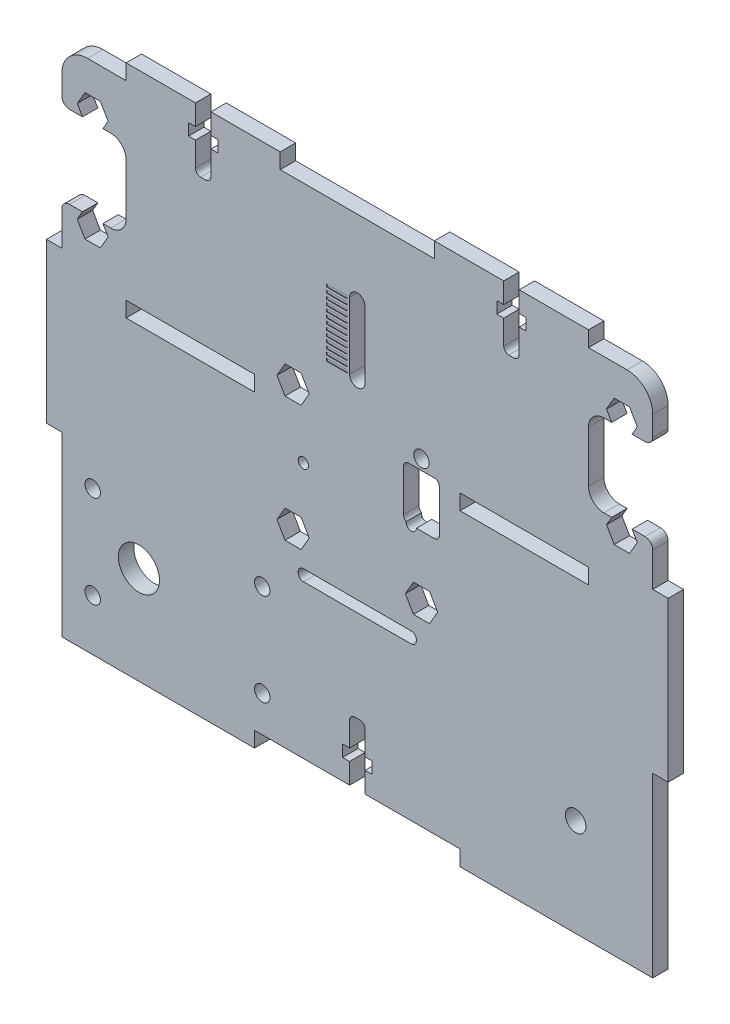
from build123d import *

# Parameters (mm, degrees)
ESBO_O1_W                   = 115
ESBO_O1_H                   = 100
RESSALTO_EXTRUS_O1_DEPTH    = 1.5
ESBO_O2_W                   = 40
ESBO_O2_H                   = 3
ESBO_O2_W_2                 = 25
CORTE_EXTRUS_O1_DEPTH       = 77.257786488
ESBO_O3_W                   = 3
ESBO_O3_H                   = 31
ESBO_O3_W_2                 = 30
ESBO_O3_H_2                 = 3
RESSALTO_EXTRUS_O2_DEPTH    = 3
CORTE_EXTRUS_O11_DEPTH      = 81.487576681
CORTE_EXTRUS_O11_DEPTH_BACK = 81.487576681
ESBO_O30_R                  = 4
CORTE_EXTRUS_O12_DEPTH      = 81.487576681
CORTE_EXTRUS_O12_DEPTH_BACK = 81.487576681
ESBO_O31_R                  = 1.5
ESBO_O4_R                   = 2
CORTE_EXTRUS_O2_DEPTH       = 81.487576681
CUT_EXTRUDE2_DEPTH          = 81.445633816
CUT_EXTRUDE2_DEPTH_BACK     = 81.445633816
CUT_EXTRUDE6_DEPTH          = 81.487576681
CUT_EXTRUDE6_DEPTH_BACK     = 81.487576681
FILLET2_R                   = 1.5
CUT_EXTRUDE8_DEPTH          = 81.445633816
CUT_EXTRUDE8_DEPTH_BACK     = 81.445633816
CUT_EXTRUDE12_DEPTH         = 81.445633816
CUT_EXTRUDE12_DEPTH_BACK    = 81.445633816
SKETCH16_R                  = 1.5
CORTE_EXTRUS_O13_DEPTH      = 81.445633816
CORTE_EXTRUS_O13_DEPTH_BACK = 81.445633816
ESBO_O32_R                  = 1
CUT_EXTRUDE9_DEPTH          = 81.487576681
FILLET1_R                   = 5
SKETCH12_4_W                = 4
SKETCH12_4_H                = 0.5
CUT_EXTRUDE13_DEPTH         = 0.1


with BuildPart() as part:
    # Esboço1 → Ressalto-extrusão1 (new, symmetric)
    with BuildSketch(Plane.XY):
        Rectangle(ESBO_O1_W, ESBO_O1_H)
    extrude(amount=RESSALTO_EXTRUS_O1_DEPTH, both=True)

    # Esboço2 → Corte-extrusão1 (cut, through all)
    with BuildSketch(Plane.XY.offset(1.5)):
        with Locations((0, -48.5)):
            Rectangle(ESBO_O2_W, ESBO_O2_H)
        with Locations((-32.5, 11.5)):
            Rectangle(ESBO_O2_W_2, ESBO_O2_H)
        with Locations((32.5, 11.5)):
            Rectangle(ESBO_O2_W_2, ESBO_O2_H)
    extrude(amount=-CORTE_EXTRUS_O1_DEPTH, mode=Mode.SUBTRACT)

    # Esboço3 → Ressalto-extrusão2 (add, through all)
    with BuildSketch(Plane.XY.offset(1.5)):
        with Locations((59, 0)):
            Rectangle(ESBO_O3_W, ESBO_O3_H)
        with Locations((-59, 0)):
            Rectangle(ESBO_O3_W, ESBO_O3_H)
        with Locations((-30, 51.5)):
            Rectangle(ESBO_O3_W_2, ESBO_O3_H_2)
        with Locations((30, 51.5)):
            Rectangle(ESBO_O3_W_2, ESBO_O3_H_2)
    extrude(amount=-RESSALTO_EXTRUS_O2_DEPTH)

    # Esboço30 → Corte-extrusão11 (cut, two sides: drawn at the far end of the back side and taken through both)
    with BuildSketch(Plane(origin=(0, 0, -1.5), x_dir=(-1, 0, 0), z_dir=(0, 0, -1)).offset(-CORTE_EXTRUS_O11_DEPTH_BACK)):
        with Locations((42.5, -31)):
            Circle(ESBO_O30_R)
    extrude(amount=CORTE_EXTRUS_O11_DEPTH + CORTE_EXTRUS_O11_DEPTH_BACK, mode=Mode.SUBTRACT)

    # Esboço31 → Corte-extrusão12 (cut, two sides: drawn at the far end of the back side and taken through both)
    with BuildSketch(Plane(origin=(0, 0, -1.5), x_dir=(-1, 0, 0), z_dir=(0, 0, -1)).offset(-CORTE_EXTRUS_O12_DEPTH_BACK)):
        with Locations((51.5, -22)):
            Circle(ESBO_O31_R)
        with Locations((51.5, -40)):
            Circle(ESBO_O31_R)
        with Locations((18.5, -22)):
            Circle(ESBO_O31_R)
        with Locations((18.5, -40)):
            Circle(ESBO_O31_R)
    extrude(amount=CORTE_EXTRUS_O12_DEPTH + CORTE_EXTRUS_O12_DEPTH_BACK, mode=Mode.SUBTRACT)

    # Esboço4 → Corte-extrusão2 (cut, through all)
    with BuildSketch(Plane.XY.offset(1.5)):
        with Locations((42.5, -31)):
            Circle(ESBO_O4_R)
    extrude(amount=-CORTE_EXTRUS_O2_DEPTH, mode=Mode.SUBTRACT)

    # Sketch5 → Cut-Extrude2 (cut, two sides: drawn at the far end of the back side and taken through both)
    with BuildSketch(Plane.XY.offset(-CUT_EXTRUDE2_DEPTH_BACK)):
        with BuildLine():
            Line((-1.5, -47), (1.5, -47))
            Line((1.5, -47), (1.5, -43))
            Line((1.5, -43), (2.85, -43))
            Line((2.85, -43), (2.85, -40.73))
            Line((2.85, -40.73), (1.5, -40.73))
            Line((1.5, -40.73), (1.5, -36))
            ThreePointArc((1.5, -36), (1.207106781, -35.292893219), (0.5, -35))
            Line((0.5, -35), (-0.5, -35))
            ThreePointArc((-0.5, -35), (-1.207106781, -35.292893219), (-1.5, -36))
            Line((-1.5, -36), (-1.5, -40.73))
            Line((-1.5, -40.73), (-2.85, -40.73))
            Line((-2.85, -40.73), (-2.85, -43))
            Line((-2.85, -43), (-1.5, -43))
            Line((-1.5, -43), (-1.5, -47))
        make_face()
    extrude(amount=CUT_EXTRUDE2_DEPTH + CUT_EXTRUDE2_DEPTH_BACK, mode=Mode.SUBTRACT)

    # Sketch8 → Cut-Extrude6 (cut, two sides: drawn at the far end of the back side and taken through both)
    with BuildSketch(Plane.XY.offset(1.5).offset(-CUT_EXTRUDE6_DEPTH_BACK)):
        with BuildLine():
            Line((-57.5, 39.651923789), (-53.489637029, 39.651923789))
            Line((-53.489637029, 39.651923789), (-54.5, 41.401923789))
            Line((-54.5, 41.401923789), (-53, 44))
            Line((-53, 44), (-50, 44))
            Line((-50, 44), (-48.5, 41.401923789))
            Line((-48.5, 41.401923789), (-49.510362971, 39.651923789))
            Line((-49.510362971, 39.651923789), (-48, 39.651923789))
            ThreePointArc((-48, 39.651923789), (-45.878679656, 38.773244132), (-45, 36.651923789))
            Line((-45, 36.651923789), (-45, 26.651923789))
            ThreePointArc((-45, 26.651923789), (-45.878679656, 24.530603445), (-48, 23.651923789))
            Line((-48, 23.651923789), (-49.510362971, 23.651923789))
            Line((-49.510362971, 23.651923789), (-48.5, 21.901923789))
            Line((-48.5, 21.901923789), (-50, 19.303847577))
            Line((-50, 19.303847577), (-53, 19.303847577))
            Line((-53, 19.303847577), (-54.5, 21.901923789))
            Line((-54.5, 21.901923789), (-53.489637029, 23.651923789))
            Line((-53.489637029, 23.651923789), (-57.5, 23.651923789))
            Line((-57.5, 23.651923789), (-57.5, 39.651923789))
        make_face()
        with BuildLine():
            Line((49.510362971, 23.651923789), (48, 23.651923789))
            ThreePointArc((48, 23.651923789), (45.878679656, 24.530603445), (45, 26.651923789))
            Line((45, 26.651923789), (45, 36.651923789))
            ThreePointArc((45, 36.651923789), (45.878679656, 38.773244132), (48, 39.651923789))
            Line((48, 39.651923789), (49.510362971, 39.651923789))
            Line((49.510362971, 39.651923789), (48.5, 41.401923789))
            Line((48.5, 41.401923789), (50, 44))
            Line((50, 44), (53, 44))
            Line((53, 44), (54.5, 41.401923789))
            Line((54.5, 41.401923789), (53.489637029, 39.651923789))
            Line((53.489637029, 39.651923789), (57.5, 39.651923789))
            Line((57.5, 39.651923789), (57.5, 23.651923789))
            Line((57.5, 23.651923789), (53.489637029, 23.651923789))
            Line((53.489637029, 23.651923789), (54.5, 21.901923789))
            Line((54.5, 21.901923789), (53, 19.303847577))
            Line((53, 19.303847577), (50, 19.303847577))
            Line((50, 19.303847577), (48.5, 21.901923789))
            Line((48.5, 21.901923789), (49.510362971, 23.651923789))
        make_face()
    extrude(amount=CUT_EXTRUDE6_DEPTH + CUT_EXTRUDE6_DEPTH_BACK, mode=Mode.SUBTRACT)

    # Fillet2
    fillet2_edges = [part.edges().sort_by_distance(p)[0] for p in [
        (-57.5, 23.651923789, 0),
        (-57.5, 39.651923789, 0),
        (57.5, 23.651923789, 0),
        (57.5, 39.651923789, 0),
    ]]
    fillet(fillet2_edges, radius=FILLET2_R)

    # Sketch11 → Cut-Extrude8 (cut, two sides: drawn at the far end of the back side and taken through both)
    with BuildSketch(Plane.XY.offset(-CUT_EXTRUDE8_DEPTH_BACK)):
        with BuildLine():
            Line((-31.5, 53), (-28.5, 53))
            Line((-28.5, 53), (-28.5, 49))
            Line((-28.5, 49), (-27.15, 49))
            Line((-27.15, 49), (-27.15, 46.73))
            Line((-27.15, 46.73), (-28.5, 46.73))
            Line((-28.5, 46.73), (-28.5, 42))
            ThreePointArc((-28.5, 42), (-28.792893219, 41.292893219), (-29.5, 41))
            Line((-29.5, 41), (-30.5, 41))
            ThreePointArc((-30.5, 41), (-31.207106781, 41.292893219), (-31.5, 42))
            Line((-31.5, 42), (-31.5, 46.73))
            Line((-31.5, 46.73), (-32.85, 46.73))
            Line((-32.85, 46.73), (-32.85, 49))
            Line((-32.85, 49), (-31.5, 49))
            Line((-31.5, 49), (-31.5, 53))
        make_face()
        with BuildLine():
            Line((28.5, 46.73), (27.15, 46.73))
            Line((27.15, 46.73), (27.15, 49))
            Line((27.15, 49), (28.5, 49))
            Line((28.5, 49), (28.5, 53))
            Line((28.5, 53), (31.5, 53))
            Line((31.5, 53), (31.5, 49))
            Line((31.5, 49), (32.85, 49))
            Line((32.85, 49), (32.85, 46.73))
            Line((32.85, 46.73), (31.5, 46.73))
            Line((31.5, 46.73), (31.5, 42))
            ThreePointArc((31.5, 42), (31.207106781, 41.292893219), (30.5, 41))
            Line((30.5, 41), (29.5, 41))
            ThreePointArc((29.5, 41), (28.792893219, 41.292893219), (28.5, 42))
            Line((28.5, 42), (28.5, 46.73))
        make_face()
    extrude(amount=CUT_EXTRUDE8_DEPTH + CUT_EXTRUDE8_DEPTH_BACK, mode=Mode.SUBTRACT)

    # Sketch16 → Cut-Extrude12 (cut, two sides: drawn at the far end of the back side and taken through both)
    with BuildSketch(Plane.XY.offset(-CUT_EXTRUDE12_DEPTH_BACK)):
        with Locations((12.5, 15.019319768)):
            Circle(SKETCH16_R)
        Polygon((15.64, -9.280680232), (14.07, -6.561360464), (10.93, -6.561360464), (9.36, -9.280680232), (10.93, -12), (14.07, -12), align=None)
        with BuildLine():
            Line((10, 13.019319768), (15, 13.019319768))
            ThreePointArc((15, 13.019319768), (15.707106781, 12.726426549), (16, 12.019319768))
            Line((16, 12.019319768), (16, 3.819319768))
            ThreePointArc((16, 3.819319768), (15.707106781, 3.112212987), (15, 2.819319768))
            Line((15, 2.819319768), (10, 2.819319768))
            ThreePointArc((10, 2.819319768), (9.292893219, 3.112212987), (9, 3.819319768))
            Line((9, 3.819319768), (9, 12.019319768))
            ThreePointArc((9, 12.019319768), (9.292893219, 12.726426549), (10, 13.019319768))
        make_face()
        Polygon((-9.36, 15.019319768), (-10.93, 17.738639536), (-14.07, 17.738639536), (-15.64, 15.019319768), (-14.07, 12.3), (-10.93, 12.3), align=None)
        Polygon((-9.36, -9.280680232), (-10.93, -6.561360464), (-14.07, -6.561360464), (-15.64, -9.280680232), (-14.07, -12), (-10.93, -12), align=None)
    extrude(amount=CUT_EXTRUDE12_DEPTH + CUT_EXTRUDE12_DEPTH_BACK, mode=Mode.SUBTRACT)

    # Esboço32 → Corte-extrusão13 (cut, two sides: drawn at the far end of the back side and taken through both)
    with BuildSketch(Plane.XY.offset(-CORTE_EXTRUS_O13_DEPTH_BACK)):
        with Locations((-10.5, 2.82)):
            Circle(ESBO_O32_R)
        with Locations((10.5, 2.82)):
            Circle(ESBO_O32_R)
        with BuildLine():
            Line((-10.5, -15), (10.5, -15))
            ThreePointArc((10.5, -15), (11.207106781, -15.292893219), (11.5, -16))
            Line((11.5, -16), (11.5, -16.2))
            ThreePointArc((11.5, -16.2), (11.207106781, -16.907106781), (10.5, -17.2))
            Line((10.5, -17.2), (-10.5, -17.2))
            ThreePointArc((-10.5, -17.2), (-11.207106781, -16.907106781), (-11.5, -16.2))
            Line((-11.5, -16.2), (-11.5, -16))
            ThreePointArc((-11.5, -16), (-11.207106781, -15.292893219), (-10.5, -15))
        make_face()
    extrude(amount=CORTE_EXTRUS_O13_DEPTH + CORTE_EXTRUS_O13_DEPTH_BACK, mode=Mode.SUBTRACT)

    # Sketch12 → Cut-Extrude9 (cut, through all)
    with BuildSketch(Plane.XY.offset(1.5)):
        with BuildLine():
            Line((1.5, 22.238639536), (1.5, 35.238639536))
            ThreePointArc((1.5, 35.238639536), (0, 36.738639536), (-1.5, 35.238639536))
            Line((-1.5, 35.238639536), (-1.5, 22.238639536))
            ThreePointArc((-1.5, 22.238639536), (0, 20.738639536), (1.5, 22.238639536))
        make_face()
        with BuildLine():
            ThreePointArc((1.5, 35.238639536), (0, 36.738639536), (-1.5, 35.238639536))
            Line((-1.5, 35.238639536), (-1.5, 22.238639536))
            ThreePointArc((-1.5, 22.238639536), (0, 20.738639536), (1.5, 22.238639536))
            Line((1.5, 22.238639536), (1.5, 35.238639536))
        make_face()
    extrude(amount=-CUT_EXTRUDE9_DEPTH, mode=Mode.SUBTRACT)

    # Fillet1
    fillet1_edges = [part.edges().sort_by_distance(p)[0] for p in [
        (-57.5, 50, 0),
        (57.5, 50, 0),
    ]]
    fillet(fillet1_edges, radius=FILLET1_R)

    # Sketch12<4> → Cut-Extrude13 (cut)
    with BuildSketch(Plane.XY.offset(1.5)):
        with Locations((-4, 33.946972869)):
            Rectangle(SKETCH12_4_W, SKETCH12_4_H)
        with Locations((-4, 32.905306202)):
            Rectangle(SKETCH12_4_W, SKETCH12_4_H)
        with Locations((-4, 30.821972869)):
            Rectangle(SKETCH12_4_W, SKETCH12_4_H)
        with Locations((-4, 29.780306202)):
            Rectangle(SKETCH12_4_W, SKETCH12_4_H)
        with Locations((-4, 26.655306202)):
            Rectangle(SKETCH12_4_W, SKETCH12_4_H)
        with Locations((-4, 24.571972869)):
            Rectangle(SKETCH12_4_W, SKETCH12_4_H)
        with Locations((-4, 34.988639536)):
            Rectangle(SKETCH12_4_W, SKETCH12_4_H)
        with Locations((-4, 31.863639536)):
            Rectangle(SKETCH12_4_W, SKETCH12_4_H)
        with Locations((-4, 28.738639536)):
            Rectangle(SKETCH12_4_W, SKETCH12_4_H)
        with Locations((-4, 27.696972869)):
            Rectangle(SKETCH12_4_W, SKETCH12_4_H)
        with Locations((-4, 25.613639536)):
            Rectangle(SKETCH12_4_W, SKETCH12_4_H)
        with Locations((-4, 23.530306202)):
            Rectangle(SKETCH12_4_W, SKETCH12_4_H)
        with Locations((-4, 22.488639536)):
            Rectangle(SKETCH12_4_W, SKETCH12_4_H)
    extrude(amount=-CUT_EXTRUDE13_DEPTH, mode=Mode.SUBTRACT)


solid = part.part
